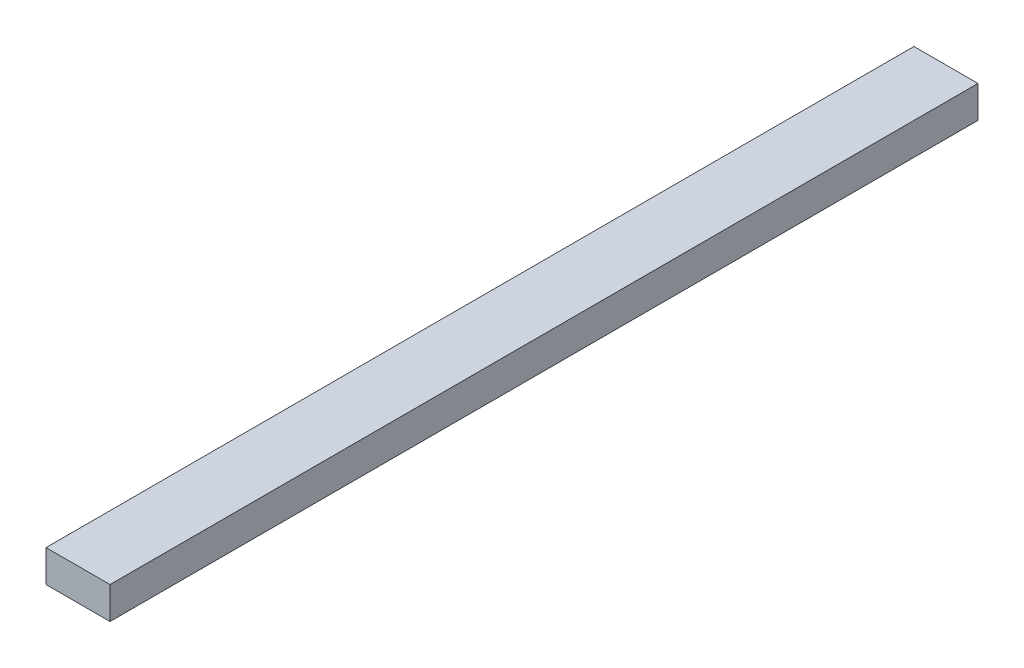
from build123d import *

# Parameters (mm, degrees)
SKETCH1_W           = 40
SKETCH1_H           = 20
BOSS_EXTRUDE1_DEPTH = 542.2


with BuildPart() as part:
    # Sketch1 → Boss-Extrude1 (new body)
    with BuildSketch(Plane.XY):
        with Locations((20, 10)):
            Rectangle(SKETCH1_W, SKETCH1_H)
    extrude(amount=BOSS_EXTRUDE1_DEPTH)


solid = part.part
